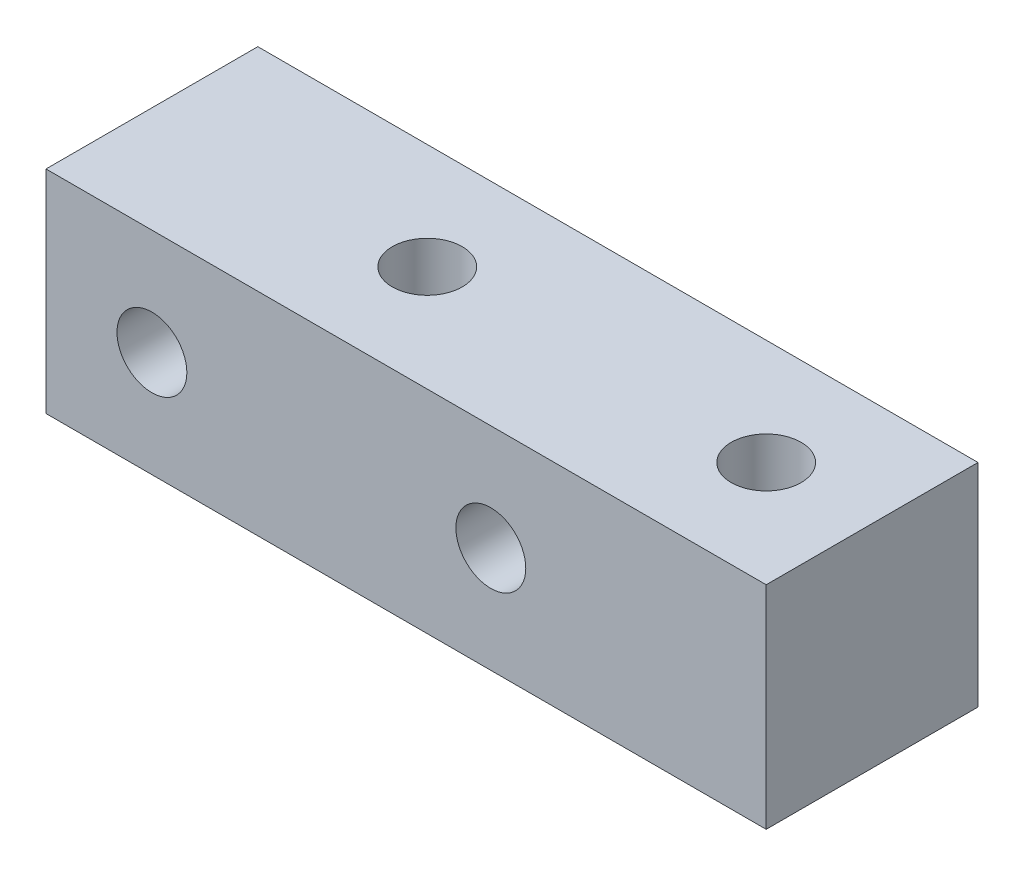
from build123d import *

# Parameters (mm, degrees)
SKETCH_1_W         = 34
SKETCH_1_H         = 10
EXTRUDE_1_DEPTH    = 10
HOLE_WIZARD_M4_1_D = 3.3
HOLE_WIZARD_M4_3_D = 3.3


with BuildPart() as part:
    # 草图1 → 凸台-拉伸1 (new body)
    with BuildSketch(Plane(origin=(0, 0, 0), x_dir=(1, 0, 0), z_dir=(0, 1, 0))):
        Rectangle(SKETCH_1_W, SKETCH_1_H)
    extrude(amount=EXTRUDE_1_DEPTH)

    # M4 螺纹孔1 (through all)
    with Locations(Plane.XY.offset(5)):
        with Locations((4, 5), (-12, 5)):
            Hole(HOLE_WIZARD_M4_1_D / 2)

    # M4 螺纹孔3 (through all)
    with Locations(Plane(origin=(0, 10, 0), x_dir=(1, 0, 0), z_dir=(0, 1, 0))):
        with Locations((-4, 0), (12, 0)):
            Hole(HOLE_WIZARD_M4_3_D / 2)


solid = part.part
